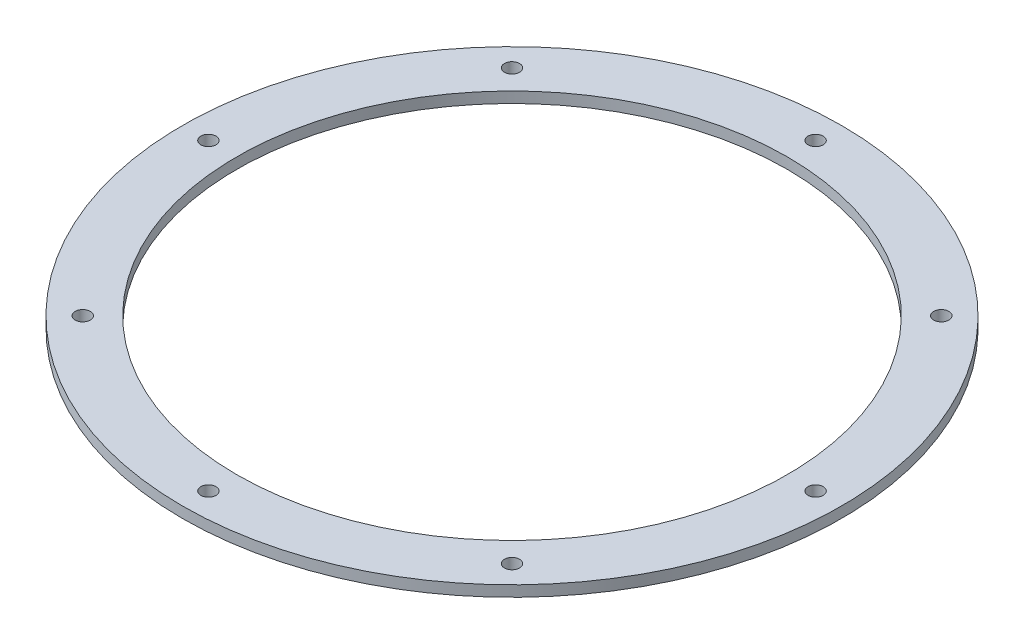
from build123d import *

# Parameters (mm, degrees)
SKETCH_1_W          = 15
SKETCH_1_H          = 3
SKETCH_2_R          = 2.1
CUT_EXTRUDE_1_DEPTH = 10


with BuildPart() as part:
    # 草图1 → 旋转1 (revolve)
    with BuildSketch(Plane.XY, mode=Mode.PRIVATE) as revolve_1_sk:
        with Locations((83.58, 1.5)):
            Rectangle(SKETCH_1_W, SKETCH_1_H)
    revolve(revolve_1_sk.sketch.rotate(Axis((0, 0, 0), (0, 1, 0)), 90), axis=Axis((0, 0, 0), (0, 1, 0)))

    # 草图2 → 切除-拉伸1 (cut)
    with BuildSketch(Plane(origin=(0, 3, 0), x_dir=(1, 0, 0), z_dir=(0, 1, 0))):
        with Locations(Location((-83.9, 0, 0), (0, 0, 270))):
            Circle(SKETCH_2_R)
        with Locations(Location((-59.326258942, 59.326258942, 0), (0, 0, 270))):
            Circle(SKETCH_2_R)
        with Locations(Location((0, 83.9, 0), (0, 0, 270))):
            Circle(SKETCH_2_R)
        with Locations(Location((59.326258942, 59.326258942, 0), (0, 0, 270))):
            Circle(SKETCH_2_R)
        with Locations(Location((83.9, 0, 0), (0, 0, 270))):
            Circle(SKETCH_2_R)
        with Locations(Location((59.326258942, -59.326258942, 0), (0, 0, 270))):
            Circle(SKETCH_2_R)
        with Locations(Location((0, -83.9, 0), (0, 0, 270))):
            Circle(SKETCH_2_R)
        with Locations(Location((-59.326258942, -59.326258942, 0), (0, 0, 270))):
            Circle(SKETCH_2_R)
    extrude(amount=-CUT_EXTRUDE_1_DEPTH, mode=Mode.SUBTRACT)


solid = part.part
